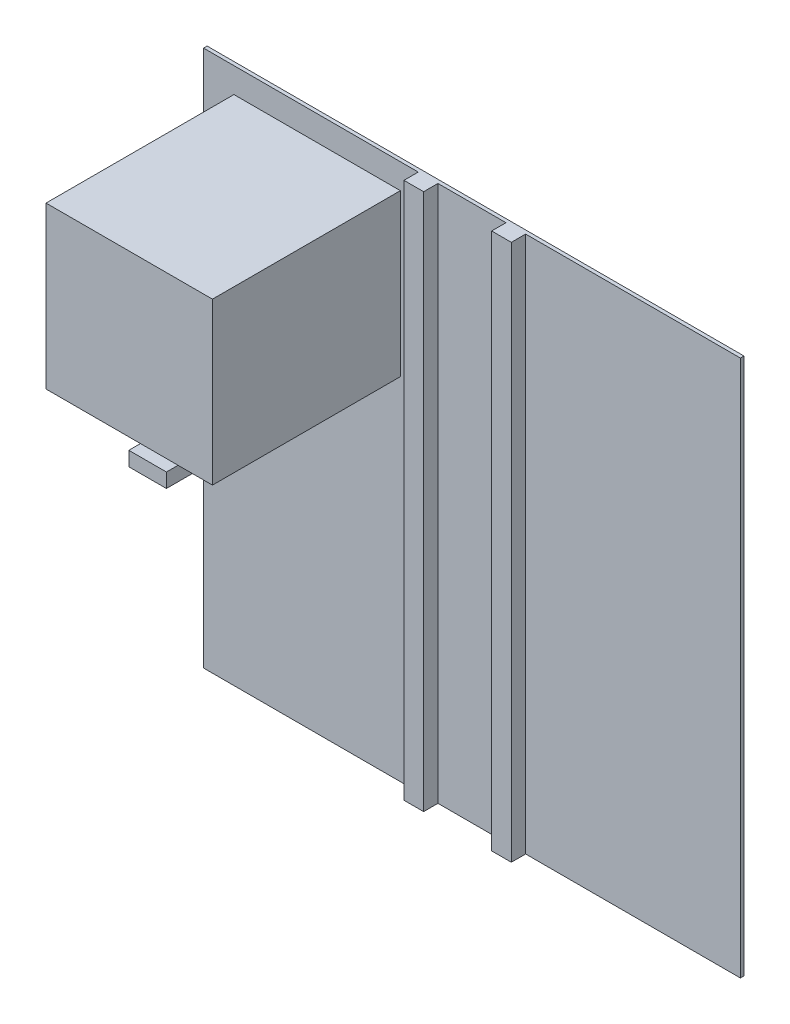
from build123d import *

# Parameters (mm, degrees)
SKETCH1_W           = 1500
SKETCH1_H           = 1500
BOSS_EXTRUDE1_DEPTH = 10
SKETCH2_W           = 465
SKETCH2_H           = 450
BOSS_EXTRUDE2_DEPTH = 525
SKETCH3_W           = 105
SKETCH3_H           = 557.5
BOSS_EXTRUDE3_DEPTH = 40
BOSS_EXTRUDE4_DEPTH = 65
SKETCH4_W           = 55
SKETCH4_H           = 1500
BOSS_EXTRUDE5_DEPTH = 40


with BuildPart() as part:
    # Sketch1 → Boss-Extrude1 (new body)
    with BuildSketch(Plane.XY):
        with Locations((-750, 750)):
            Rectangle(SKETCH1_W, SKETCH1_H)
    extrude(amount=BOSS_EXTRUDE1_DEPTH)

    # Sketch2 → Boss-Extrude2 (add)
    with BuildSketch(Plane.XY.offset(10)):
        with Locations((-1182.5, 1205)):
            Rectangle(SKETCH2_W, SKETCH2_H)
    extrude(amount=BOSS_EXTRUDE2_DEPTH)

    # Sketch3 → Boss-Extrude3 (add)
    with BuildSketch(Plane.XZ.offset(-980)):
        with Locations((-1098.62392171, 288.75)):
            Rectangle(SKETCH3_W, SKETCH3_H)
    extrude(amount=BOSS_EXTRUDE3_DEPTH)

    # Sketch3<3> → Boss-Extrude4 (add)
    with BuildSketch(Plane.XZ.offset(-980)):
        with BuildLine():
            ThreePointArc((-1046.12392171, 339.348709786), (-1098.62392171, 357.5), (-1151.12392171, 339.348709786))
            Line((-1151.12392171, 339.348709786), (-1151.12392171, 205.651290214))
            ThreePointArc((-1151.12392171, 205.651290214), (-1098.62392171, 187.5), (-1046.12392171, 205.651290214))
            Line((-1046.12392171, 205.651290214), (-1046.12392171, 339.348709786))
        make_face()
    extrude(amount=BOSS_EXTRUDE4_DEPTH)

    # Sketch4 → Boss-Extrude5 (add)
    with BuildSketch(Plane.XY.offset(10)):
        with Locations((-872.5, 750)):
            Rectangle(SKETCH4_W, SKETCH4_H)
        with Locations((-627.5, 750)):
            Rectangle(SKETCH4_W, SKETCH4_H)
    extrude(amount=BOSS_EXTRUDE5_DEPTH)


solid = part.part
